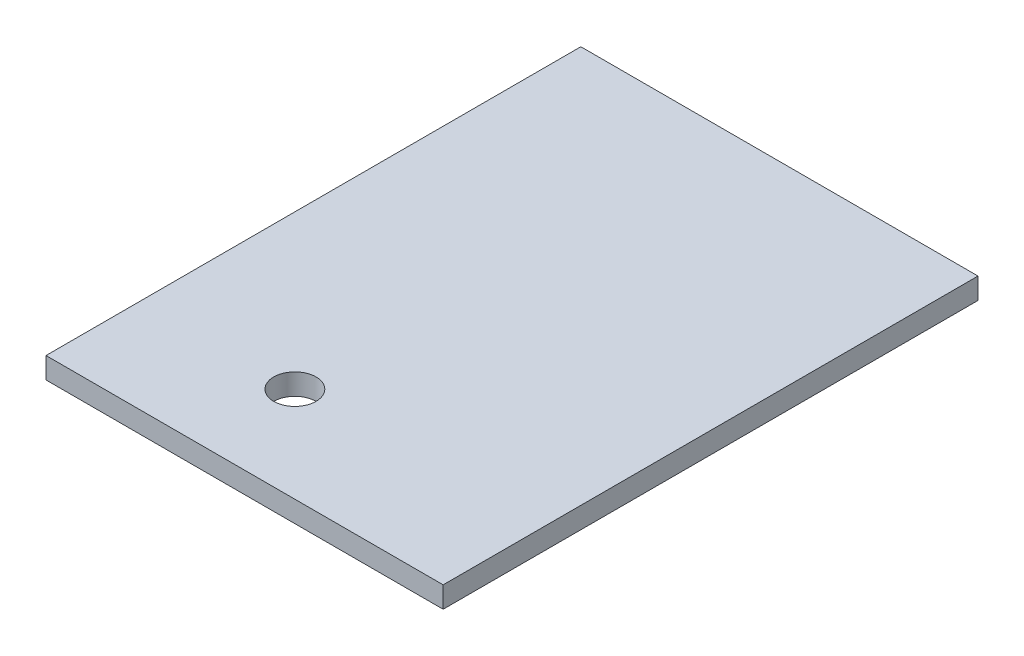
from build123d import *

# Parameters (mm, degrees)
SKETCH1_W           = 37.5
SKETCH1_H           = 50.5
BOSS_EXTRUDE1_DEPTH = 2
SKETCH2_R           = 2
CUT_EXTRUDE1_DEPTH  = 32.513885828


with BuildPart() as part:
    # Sketch1 → Boss-Extrude1 (new body)
    with BuildSketch(Plane(origin=(0, 0, 0), x_dir=(1, 0, 0), z_dir=(0, 1, 0))):
        Rectangle(SKETCH1_W, SKETCH1_H)
    extrude(amount=BOSS_EXTRUDE1_DEPTH)

    # Sketch2 → Cut-Extrude1 (cut, through all)
    with BuildSketch(Plane(origin=(0, 2, 0), x_dir=(1, 0, 0), z_dir=(0, 1, 0))):
        with Locations(Location((-4.25, -16.25, 0), (0, 0, 270))):
            Circle(SKETCH2_R)
    extrude(amount=-CUT_EXTRUDE1_DEPTH, mode=Mode.SUBTRACT)


solid = part.part
